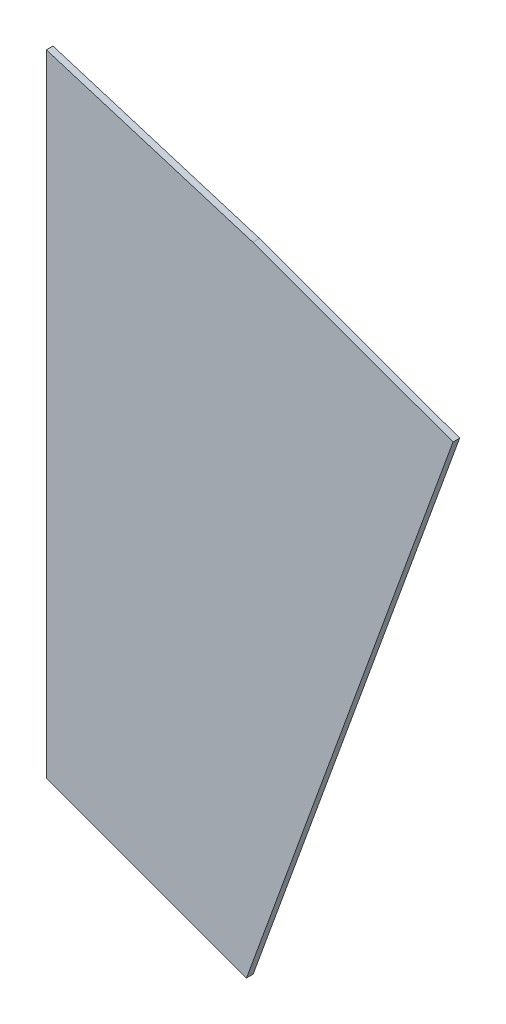
from build123d import *

# Parameters (mm, degrees)
BOSS_EXTRUDE1_DEPTH = 1.6002


with BuildPart() as part:
    # Sketch1 → Boss-Extrude1 (new body)
    with BuildSketch(Plane.XY):
        Polygon((0, 0), (0, 152.4), (49.896254981, 137.088833876), (98.251843088, 119.488839144), (48.355588107, -17.599994731), align=None)
    extrude(amount=BOSS_EXTRUDE1_DEPTH)


solid = part.part
